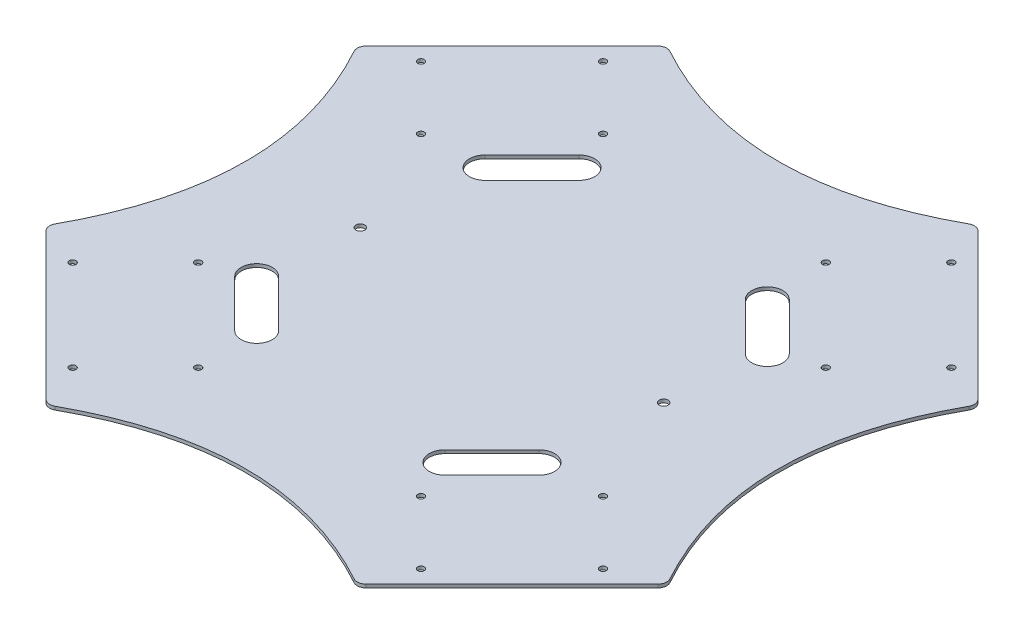
from build123d import *

# Parameters (mm, degrees)
DODANIE_WYCI_GNI_CIE1_DEPTH = 1.5
ZAOKR_GLENIE1_R             = 4
SZKIC2_R                    = 1.5
WYTNIJ_WYCI_GNI_CIE1_DEPTH  = 197.62293997
SZYK_KO_OWY1_COUNT          = 4
WYTNIJ_WYCI_GNI_CIE2_REACH  = 198.623
SZYK_KO_OWY2_COUNT          = 4
WYTNIJ_WYCI_GNI_CIE3_REACH  = 198.623
SZKIC4_R                    = 2


with BuildPart() as part:
    # Szkic1 → Dodanie-wyciągnięcie1 (new body)
    with BuildSketch(Plane(origin=(0, 0, 0), x_dir=(1, 0, 0), z_dir=(0, 1, 0))):
        with BuildLine():
            Line((-70, -140), (-140, -70))
            add(Edge.make_bspline(
                [(-140, 70), (-100, 0), (-140, -70)],
                knots=[0, 0, 0, 1, 1, 1], degree=2))
            Line((-140, 70), (-70, 140))
            add(Edge.make_bspline(
                [(70, 140), (0, 100), (-70, 140)],
                knots=[0, 0, 0, 1, 1, 1], degree=2))
            Line((70, 140), (140, 70))
            add(Edge.make_bspline(
                [(140, -70), (100, 0), (140, 70)],
                knots=[0, 0, 0, 1, 1, 1], degree=2))
            Line((140, -70), (70, -140))
            add(Edge.make_bspline(
                [(-70, -140), (0, -100), (70, -140)],
                knots=[0, 0, 0, 1, 1, 1], degree=2))
        make_face()
    extrude(amount=DODANIE_WYCI_GNI_CIE1_DEPTH)

    # Zaokrąglenie1
    zaokr_glenie1_edges = [part.edges().sort_by_distance(p)[0] for p in [
        (-140, 0.75, -70),
        (-70, 0.75, -140),
        (70, 0.75, -140),
        (140, 0.75, -70),
        (140, 0.75, 70),
        (70, 0.75, 140),
        (-140, 0.75, 70),
        (-70, 0.75, 140),
    ]]
    fillet(zaokr_glenie1_edges, radius=ZAOKR_GLENIE1_R)

    # Szkic2 → Wytnij-wyciągnięcie1 (cut, through all)
    with BuildSketch(Plane(origin=(0, 1.5, 0), x_dir=(1, 0, 0), z_dir=(0, 1, 0))):
        with Locations((-78.488852712, -119.501046021)):
            Circle(SZKIC2_R)
        with Locations((-119.501046021, -78.488852712)):
            Circle(SZKIC2_R)
        with Locations((-50.204581464, -91.216774773)):
            Circle(SZKIC2_R)
        with Locations((-91.216774773, -50.204581464)):
            Circle(SZKIC2_R)
    wytnij_wyci_gni_cie1 = extrude(amount=-WYTNIJ_WYCI_GNI_CIE1_DEPTH, mode=Mode.SUBTRACT)

    # Szyk kołowy1: Wytnij-wyciągnięcie1 ×4 about axis
    szyk_ko_owy1_axis = Axis((0, -82.27937755, 0), (0, 1, 0))
    for i in range(1, SZYK_KO_OWY1_COUNT):
        add(wytnij_wyci_gni_cie1.rotate(szyk_ko_owy1_axis, i * 360 / SZYK_KO_OWY1_COUNT), mode=Mode.SUBTRACT)

    # Szkic3 → Wytnij-wyciągnięcie2 (cut, up to next)
    with BuildSketch(Plane(origin=(0, 1.5, 0), x_dir=(1, 0, 0), z_dir=(0, 1, 0)), mode=Mode.PRIVATE) as wytnij_wyci_gni_cie2_sk1:
        with BuildLine():
            Line((-47.355448856, 77.60029226), (-68.568652292, 56.387088824))
            ThreePointArc((-68.568652292, 56.387088824), (-68.568652292, 46.487593888), (-58.669157355, 46.487593888))
            Line((-58.669157355, 46.487593888), (-37.45595392, 67.700797323))
            ThreePointArc((-37.45595392, 67.700797323), (-37.45595392, 77.60029226), (-47.355448856, 77.60029226))
        make_face()
    wytnij_wyci_gni_cie2_tool1 = extrude(wytnij_wyci_gni_cie2_sk1.sketch, amount=-WYTNIJ_WYCI_GNI_CIE2_REACH, mode=Mode.PRIVATE) & part.part
    wytnij_wyci_gni_cie2 = wytnij_wyci_gni_cie2_tool1.solids().sort_by_distance((-53.012303, 1.5, -62.043943))[0]
    add(wytnij_wyci_gni_cie2, mode=Mode.SUBTRACT)

    # Szyk kołowy2: Wytnij-wyciągnięcie2 ×4 about axis
    szyk_ko_owy2_axis = Axis((0, -82.27937755, 0), (0, 1, 0))
    for i in range(1, SZYK_KO_OWY2_COUNT):
        add(wytnij_wyci_gni_cie2.rotate(szyk_ko_owy2_axis, i * 360 / SZYK_KO_OWY2_COUNT), mode=Mode.SUBTRACT)

    # Szkic4 → Wytnij-wyciągnięcie3 (cut, up to next)
    with BuildSketch(Plane(origin=(0, 1.5, 0), x_dir=(1, 0, 0), z_dir=(0, 1, 0)), mode=Mode.PRIVATE) as wytnij_wyci_gni_cie3_sk1:
        with Locations((-68.34, 0)):
            Circle(SZKIC4_R)
    wytnij_wyci_gni_cie3_tool1 = extrude(wytnij_wyci_gni_cie3_sk1.sketch, amount=-WYTNIJ_WYCI_GNI_CIE3_REACH, mode=Mode.PRIVATE) & part.part
    # Szkic4 → Wytnij-wyciągnięcie3 (cut, up to next)
    with BuildSketch(Plane(origin=(0, 1.5, 0), x_dir=(1, 0, 0), z_dir=(0, 1, 0)), mode=Mode.PRIVATE) as wytnij_wyci_gni_cie3_sk2:
        with Locations((68.34, 0)):
            Circle(SZKIC4_R)
    wytnij_wyci_gni_cie3_tool2 = extrude(wytnij_wyci_gni_cie3_sk2.sketch, amount=-WYTNIJ_WYCI_GNI_CIE3_REACH, mode=Mode.PRIVATE) & part.part
    add(wytnij_wyci_gni_cie3_tool1.solids().sort_by_distance((-68.34, 1.5, 0))[0], mode=Mode.SUBTRACT)
    add(wytnij_wyci_gni_cie3_tool2.solids().sort_by_distance((68.34, 1.5, 0))[0], mode=Mode.SUBTRACT)


solid = part.part
